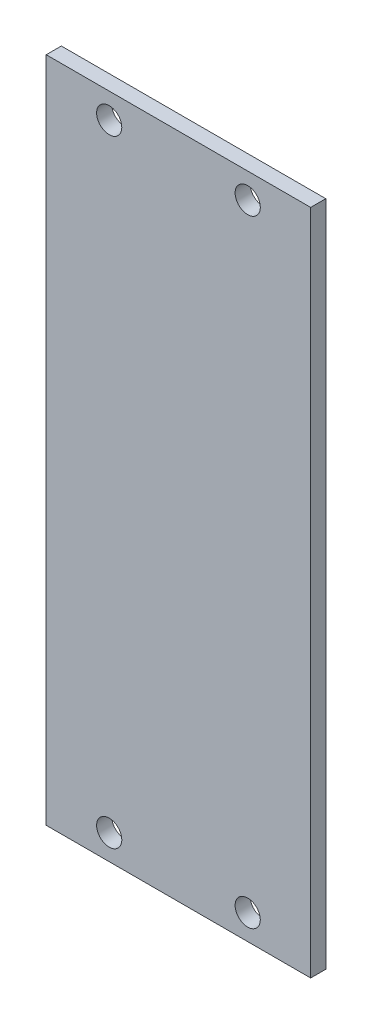
from build123d import *

# Parameters (mm, degrees)
SKETCH_1_W      = 21
SKETCH_1_H      = 53
SKETCH_1_R      = 1
EXTRUDE_1_DEPTH = 1.2


with BuildPart() as part:
    # 草图1 → 凸台-拉伸1 (new body)
    with BuildSketch(Plane.XY):
        Rectangle(SKETCH_1_W, SKETCH_1_H)
        with Locations((-5.5, 24.5)):
            Circle(SKETCH_1_R, mode=Mode.SUBTRACT)
        with Locations(Location((5.5, 24.5, 0), (0, 0, 180))):
            Circle(SKETCH_1_R, mode=Mode.SUBTRACT)
        with Locations((5.5, -24.5)):
            Circle(SKETCH_1_R, mode=Mode.SUBTRACT)
        with Locations(Location((-5.5, -24.5, 0), (0, 0, 180))):
            Circle(SKETCH_1_R, mode=Mode.SUBTRACT)
    extrude(amount=EXTRUDE_1_DEPTH)


solid = part.part
